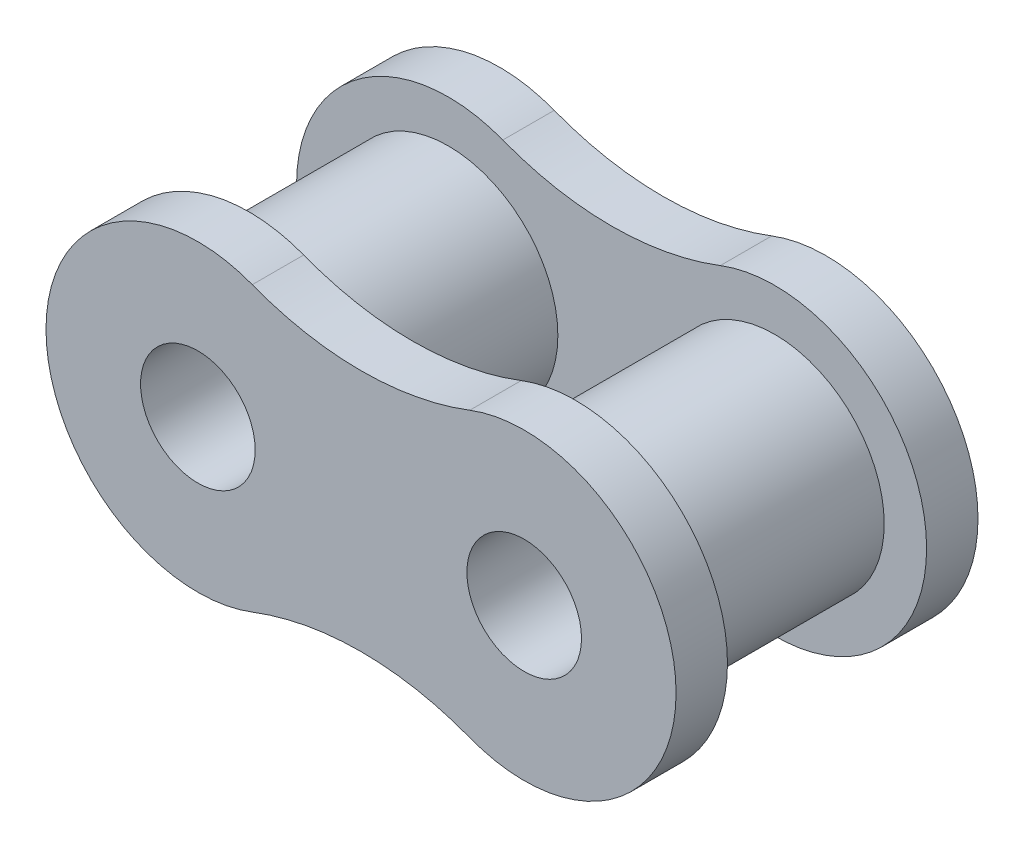
from build123d import *

# Parameters (mm, degrees)
SKETCH_1_R        = 4.26
SKETCH_1_R_2      = 2.23
EXTRUDE_1_DEPTH   = 5.875
EXTRUDE_1_2_DEPTH = 5.875
EXTRUDE_START     = 5.875
SKETCH_2_R        = 3
EXTRUDE_2_DEPTH   = 2


with BuildPart() as part:
    # Эскиз1 → Бобышка-Вытянуть1 (new, symmetric)
    with BuildSketch(Plane.XY):
        with Locations((-6.35, 0)):
            Circle(SKETCH_1_R)
        with Locations((-6.35, 0)):
            Circle(SKETCH_1_R_2, mode=Mode.SUBTRACT)
    extrude(amount=EXTRUDE_1_DEPTH, both=True)



with BuildPart() as body_2:
    # Эскиз1 → Extrude 1 2 (new, symmetric)
    with BuildSketch(Plane.XY):
        with Locations((6.35, 0)):
            Circle(SKETCH_1_R)
        with Locations((6.35, 0)):
            Circle(SKETCH_1_R_2, mode=Mode.SUBTRACT)
    extrude(amount=EXTRUDE_1_2_DEPTH, both=True)


with BuildPart() as part_1:
    add(part.part)

    add(body_2.part)  # Бобышка-Вытянуть2 merges body 2
    # Эскиз2 → Бобышка-Вытянуть2 (add)
    with BuildSketch(Plane.XY.offset(EXTRUDE_START)):
        with BuildLine():
            ThreePointArc((-4.232138826, 5.517496176), (-12.26, 0), (-4.232138826, -5.517496176))
            ThreePointArc((-4.232138826, -5.517496176), (0, -4.733152662), (4.232138826, -5.517496176))
            ThreePointArc((4.232138826, -5.517496176), (12.26, 0), (4.232138826, 5.517496176))
            ThreePointArc((4.232138826, 5.517496176), (0, 4.733152662), (-4.232138826, 5.517496176))
        make_face()
        with Locations((-6.35, 0)):
            Circle(SKETCH_2_R, mode=Mode.SUBTRACT)
        with Locations((6.35, 0)):
            Circle(SKETCH_2_R, mode=Mode.SUBTRACT)
    extrude_2 = extrude(amount=-EXTRUDE_2_DEPTH)

    # Зеркальное отражение1: Бобышка-Вытянуть2 across plane
    add(extrude_2.mirror(Plane.XY))


solid = part_1.part
